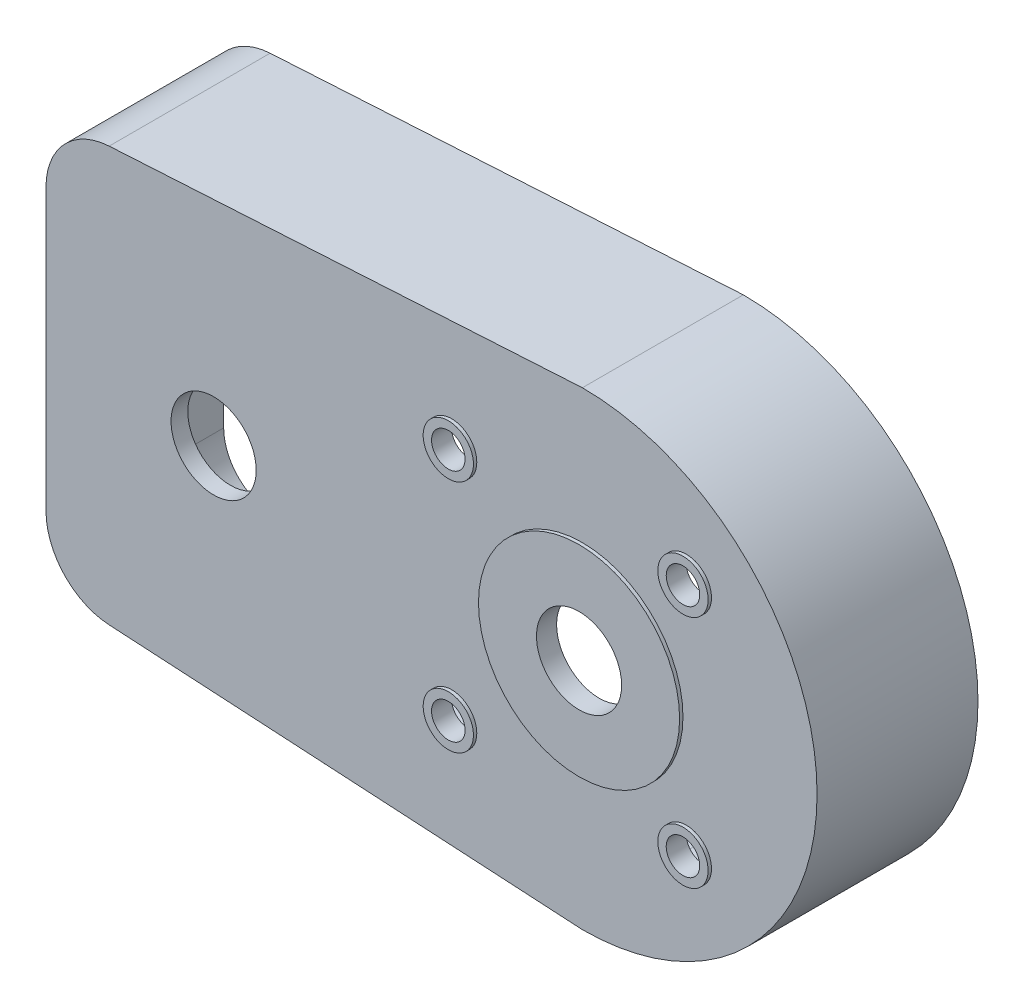
from build123d import *

# Parameters (mm, degrees)
BOSS_EXTRUDE1_DEPTH = 24
CUT_EXTRUDE1_DEPTH  = 43
SKETCH4_R           = 12.7
CUT_EXTRUDE2_DEPTH  = 43
SKETCH5_R           = 5
CUT_EXTRUDE3_DEPTH  = 43
SKETCH6_R           = 7.5
SKETCH6_R_2         = 5
SKETCH6_R_3         = 30
SKETCH6_R_4         = 11
BOSS_EXTRUDE2_DEPTH = 1
SKETCH7_R           = 12.7
CUT_EXTRUDE4_DEPTH  = 10
CUT_EXTRUDE5_START  = -10
SKETCH8_R           = 12.7
CUT_EXTRUDE5_DEPTH  = 10


with BuildPart() as part:
    # Sketch1 → Boss-Extrude1 (new, symmetric)
    with BuildSketch(Plane.XY):
        with BuildLine():
            Line((0, 41.872855029), (0, -41.872855029))
            ThreePointArc((0, -41.872855029), (5.455474373, -55.600810969), (18.845677428, -61.839515726))
            Line((18.845677428, -61.839515726), (160, -70))
            ThreePointArc((160, -70), (230, 0), (160, 70))
            Line((160, 70), (18.845677428, 61.839515726))
            ThreePointArc((18.845677428, 61.839515726), (5.455474373, 55.600810969), (0, 41.872855029))
        make_face()
    extrude(amount=BOSS_EXTRUDE1_DEPTH, both=True)

    # Sketch2 → Cut-Extrude1 (cut)
    with BuildSketch(Plane(origin=(0, 0, -24), x_dir=(-1, 0, 0), z_dir=(0, 0, -1))):
        with BuildLine():
            Line((-19.134258071, 56.847850552), (-160.141737643, 64.999845465))
            ThreePointArc((-160.141737643, 64.999845465), (-225, 0), (-160.141737643, -64.999845465))
            Line((-160.141737643, -64.999845465), (-19.134258071, -56.847850552))
            ThreePointArc((-19.134258071, -56.847850552), (-9.09160578, -52.168821984), (-5, -41.872855029))
            Line((-5, -41.872855029), (-5, 41.872855029))
            ThreePointArc((-5, 41.872855029), (-9.09160578, 52.168821984), (-19.134258071, 56.847850552))
        make_face()
    extrude(amount=-CUT_EXTRUDE1_DEPTH, mode=Mode.SUBTRACT)

    # Sketch4 → Cut-Extrude2 (cut)
    with BuildSketch(Plane.XY.offset(24)):
        with Locations((160, 0)):
            Circle(SKETCH4_R)
    extrude(amount=-CUT_EXTRUDE2_DEPTH, mode=Mode.SUBTRACT)

    # Sketch5 → Cut-Extrude3 (cut)
    with BuildSketch(Plane.XY.offset(24)):
        with Locations((121, 35)):
            Circle(SKETCH5_R)
        with Locations((191, 35)):
            Circle(SKETCH5_R)
        with Locations(Location((191, -35, 0), (0, 0, 180))):
            Circle(SKETCH5_R)
        with Locations(Location((121, -35, 0), (0, 0, 180))):
            Circle(SKETCH5_R)
    extrude(amount=-CUT_EXTRUDE3_DEPTH, mode=Mode.SUBTRACT)

    # Sketch6 → Boss-Extrude2 (add, symmetric)
    # profile 1 of 5: a face of its own
    with BuildSketch(Plane.XY.offset(24)):
        with Locations((121, 35)):
            Circle(SKETCH6_R)
        with Locations((121, 35)):
            Circle(SKETCH6_R_2, mode=Mode.SUBTRACT)
    # profile 2 of 5: a face of its own
    with BuildSketch(Plane.XY.offset(24)):
        with Locations(Location((121, -35, 0), (0, 0, 180))):
            Circle(SKETCH6_R)
        with Locations(Location((121, -35, 0), (0, 0, 180))):
            Circle(SKETCH6_R_2, mode=Mode.SUBTRACT)
    # profile 3 of 5: a face of its own
    with BuildSketch(Plane.XY.offset(24)):
        with Locations(Location((191, 35, 0), (0, 0, 180))):
            Circle(SKETCH6_R)
        with Locations(Location((191, 35, 0), (0, 0, 180))):
            Circle(SKETCH6_R_2, mode=Mode.SUBTRACT)
    # profile 4 of 5: a face of its own
    with BuildSketch(Plane.XY.offset(24)):
        with Locations((191, -35)):
            Circle(SKETCH6_R)
        with Locations((191, -35)):
            Circle(SKETCH6_R_2, mode=Mode.SUBTRACT)
    # profile 5 of 5: a face of its own
    with BuildSketch(Plane.XY.offset(24)):
        with Locations((160, 0)):
            Circle(SKETCH6_R_3)
        with Locations((160, 0)):
            Circle(SKETCH6_R_4, mode=Mode.SUBTRACT)
    extrude(amount=BOSS_EXTRUDE2_DEPTH, both=True)

    # Sketch7 → Cut-Extrude4 (cut)
    with BuildSketch(Plane.XY.offset(24)):
        with Locations((50, 0)):
            Circle(SKETCH7_R)
    extrude(amount=-CUT_EXTRUDE4_DEPTH, mode=Mode.SUBTRACT)

    # Sketch8 → Cut-Extrude5 (cut)
    with BuildSketch(Plane(origin=(0, 0, 23), x_dir=(-1, 0, 0), z_dir=(0, 0, -1)).offset(CUT_EXTRUDE5_START)):
        with Locations(Location((-160, 0, 0), (0, 0, 180))):
            Circle(SKETCH8_R)
    extrude(amount=CUT_EXTRUDE5_DEPTH, mode=Mode.SUBTRACT)


solid = part.part
